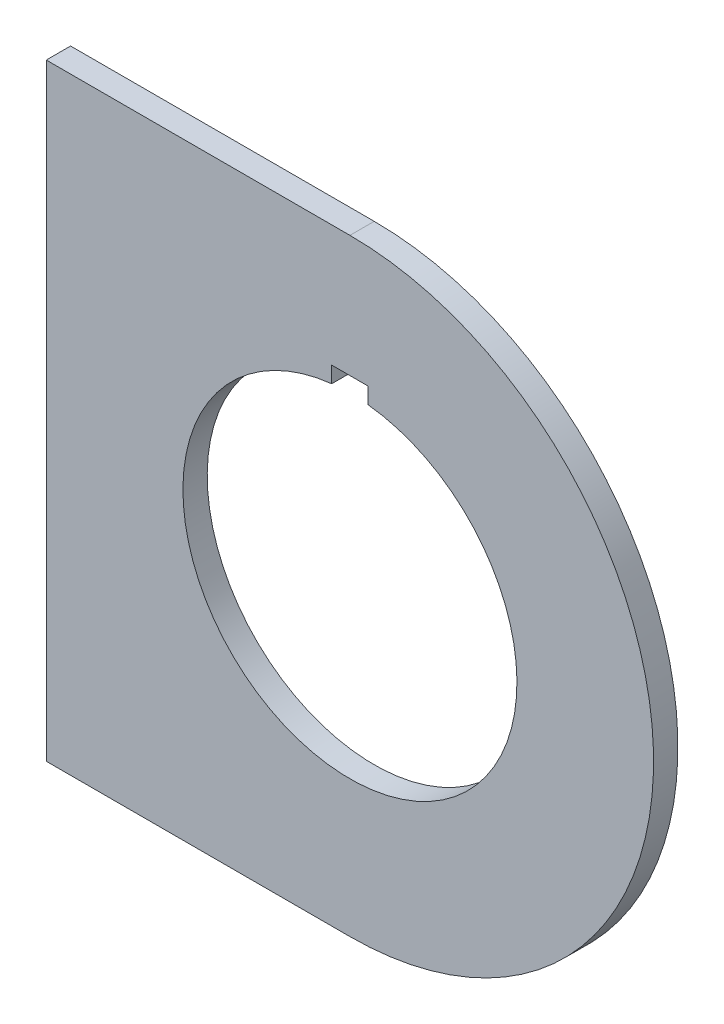
from build123d import *

# Parameters (mm, degrees)
BOSS_EXTRU_1_DEPTH = 2


with BuildPart() as part:
    # Esquisse1 → Boss.-Extru.1 (new body)
    with BuildSketch(Plane.XY):
        with BuildLine():
            Line((0, 0), (25, 0))
            ThreePointArc((25, 0), (50, 25), (25, 50))
            Line((25, 50), (0, 50))
            Line((0, 50), (0, 0))
        make_face()
        with BuildLine():
            Line((23.5, 40), (23.5, 38.667936933))
            ThreePointArc((23.5, 38.667936933), (25, 11.25), (26.5, 38.667936933))
            Line((26.5, 38.667936933), (26.5, 40))
            Line((26.5, 40), (23.5, 40))
        make_face(mode=Mode.SUBTRACT)
    extrude(amount=BOSS_EXTRU_1_DEPTH)


solid = part.part
